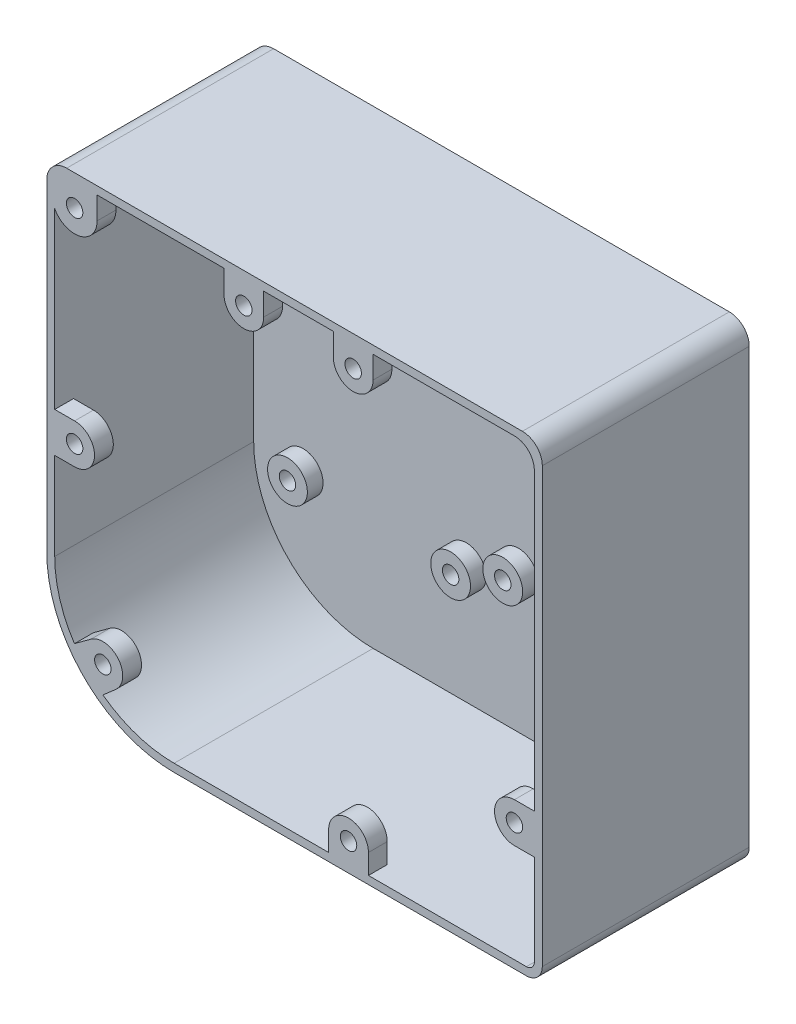
from build123d import *

# Parameters (mm, degrees)
SKETCH5_W           = 153.063311942
SKETCH5_H           = 144.779998932
BOSS_EXTRUDE4_DEPTH = 63.5
FILLET1_R           = 38.1
FILLET2_R           = 2.54
SHELL3_T            = 2.54
SKETCH7_R           = 6.35
BOSS_EXTRUDE5_DEPTH = 5
SKETCH8_R           = 2.625
CUT_EXTRUDE1_DEPTH  = 5
BOSS_EXTRUDE6_DEPTH = 6
FILLET3_R           = 6.35
SKETCH10_R          = 2.625
CUT_EXTRUDE2_DEPTH  = 58.5


with BuildPart() as part:
    # Sketch5 → Boss-Extrude4 (new body)
    with BuildSketch(Plane.XY):
        with Locations((56.058995854, 50.442319529)):
            Rectangle(SKETCH5_W, SKETCH5_H)
    extrude(amount=BOSS_EXTRUDE4_DEPTH)

    # Fillet1
    fillet1_edges = [part.edges().sort_by_distance(p)[0] for p in [
        (-20.472660117, -21.947679937, 31.75),
    ]]
    fillet(fillet1_edges, radius=FILLET1_R)

    # Fillet2
    fillet2_edges = [part.edges().sort_by_distance(p)[0] for p in [
        (132.590651825, -21.947679937, 31.75),
    ]]
    fillet(fillet2_edges, radius=FILLET2_R)

    # Shell3
    shell3_openings = [part.faces().sort_by_distance(p)[0] for p in [
        (57.024076911, 51.357711543, 63.5),
    ]]
    offset(amount=SHELL3_T, openings=shell3_openings, kind=Kind.INTERSECTION)

    # Sketch7 → Boss-Extrude5 (add)
    with BuildSketch(Plane.XY):
        with Locations((62.994650422, 112.820200594)):
            Circle(SKETCH7_R)
        with Locations((123.954650422, 111.804200594)):
            Circle(SKETCH7_R)
        with Locations((64.011650422, 22.578200594)):
            Circle(SKETCH7_R)
        with Locations((124.970650422, 22.396200594)):
            Circle(SKETCH7_R)
        with Locations((-4.569349914, 115.466318873)):
            Circle(SKETCH7_R)
        with Locations((47.373650086, 115.466318873)):
            Circle(SKETCH7_R)
        with Locations((-4.694349914, 15.752318873)):
            Circle(SKETCH7_R)
        with Locations((47.373650086, 15.771318873)):
            Circle(SKETCH7_R)
    extrude(amount=BOSS_EXTRUDE5_DEPTH)

    # Sketch8 → Cut-Extrude1 (cut)
    with BuildSketch(Plane.XY.offset(5)):
        with Locations((-4.694349914, 15.752318873)):
            Circle(SKETCH8_R)
        with Locations((47.373650086, 15.771318873)):
            Circle(SKETCH8_R)
        with Locations((64.011650422, 22.578200594)):
            Circle(SKETCH8_R)
        with Locations((124.970650422, 22.396200594)):
            Circle(SKETCH8_R)
        with Locations((47.373650086, 115.466318873)):
            Circle(SKETCH8_R)
        with Locations((-4.569349914, 115.466318873)):
            Circle(SKETCH8_R)
        with Locations((62.994650422, 112.820200594)):
            Circle(SKETCH8_R)
        with Locations((123.954650422, 111.804200594)):
            Circle(SKETCH8_R)
    extrude(amount=-CUT_EXTRUDE1_DEPTH, mode=Mode.SUBTRACT)

    # Sketch9 → Boss-Extrude6 (add)
    with BuildSketch(Plane.XY.offset(63.5)):
        with BuildLine():
            Line((-6.94761595, 115.657274828), (-6.94761595, 122.832318995))
            Line((-6.94761595, 122.832318995), (-20.472660117, 122.832318995))
            Line((-20.472660117, 122.832318995), (-20.472660117, 115.657274828))
            Line((-20.472660117, 115.657274828), (-20.472660117, 112.316801987))
            ThreePointArc((-20.472660117, 112.316801987), (-12.402234539, 108.691544814), (-6.94761595, 115.657274828))
        make_face()
        with BuildLine():
            Line((33.530571418, 115.657274828), (33.530571418, 122.832318995))
            Line((33.530571418, 122.832318995), (46.230571418, 122.832318995))
            Line((46.230571418, 122.832318995), (46.230571418, 115.657274828))
            ThreePointArc((46.230571418, 115.657274828), (39.880571418, 109.307274828), (33.530571418, 115.657274828))
        make_face()
        with BuildLine():
            Line((68.427420291, 115.710615977), (68.427420291, 122.832318995))
            Line((68.427420291, 122.832318995), (81.127420291, 122.832318995))
            Line((81.127420291, 122.832318995), (81.127420291, 115.710615977))
            ThreePointArc((81.127420291, 115.710615977), (74.777420291, 109.360615977), (68.427420291, 115.710615977))
        make_face()
        with BuildLine():
            Line((126.240651825, 22.296756738), (132.590651825, 22.296756738))
            Line((132.590651825, 22.296756738), (132.590651825, 9.596756738))
            Line((132.590651825, 9.596756738), (126.240651825, 9.596756738))
            ThreePointArc((126.240651825, 9.596756738), (119.890651825, 15.946756738), (126.240651825, 22.296756738))
        make_face()
        with BuildLine():
            Line((-8.880464125, -0.896351485), (-14.122660117, -4.742228331))
            ThreePointArc((-14.122660117, -4.742228331), (-11.33604945, -11.201095808), (-5.089054035, -14.434857763))
            Line((-5.089054035, -14.434857763), (-0.935149274, -10.7884483))
            ThreePointArc((-0.935149274, -10.7884483), (-0.173505163, -2.039817183), (-8.880464125, -0.896351485))
        make_face()
        with BuildLine():
            Line((-14.122660117, 56.792319529), (-20.472660117, 56.792319529))
            Line((-20.472660117, 56.792319529), (-20.472660117, 44.092319529))
            Line((-20.472660117, 44.092319529), (-14.122660117, 44.092319529))
            ThreePointArc((-14.122660117, 44.092319529), (-7.772660117, 50.442319529), (-14.122660117, 56.792319529))
        make_face()
        with BuildLine():
            Line((66.946411889, -15.597679937), (66.946411889, -21.947679937))
            Line((66.946411889, -21.947679937), (79.646411889, -21.947679937))
            Line((79.646411889, -21.947679937), (79.646411889, -15.597679937))
            ThreePointArc((79.646411889, -15.597679937), (73.296411889, -9.247679937), (66.946411889, -15.597679937))
        make_face()
    extrude(amount=-BOSS_EXTRUDE6_DEPTH)

    # Fillet3
    fillet3_edges = [part.edges().sort_by_distance(p)[0] for p in [
        (-20.472660117, 122.832318995, 28.75),
        (132.590651825, 122.832318995, 31.75),
        (-23.012660117, 125.372318995, 30.48),
        (135.130651825, 125.372318995, 30.48),
    ]]
    fillet(fillet3_edges, radius=FILLET3_R)

    # Sketch10 → Cut-Extrude2 (cut)
    with BuildSketch(Plane.XY.offset(63.5)):
        with Locations((-14.122660117, 115.657274828)):
            Circle(SKETCH10_R)
        with Locations((39.880571418, 115.657274828)):
            Circle(SKETCH10_R)
        with Locations((74.777420291, 115.710615977)):
            Circle(SKETCH10_R)
        with Locations((-14.122660117, 50.442319529)):
            Circle(SKETCH10_R)
        with Locations((-5.124288877, -6.016277999)):
            Circle(SKETCH10_R)
        with Locations((73.296411889, -15.597679937)):
            Circle(SKETCH10_R)
        with Locations((126.240651825, 15.946756738)):
            Circle(SKETCH10_R)
    extrude(amount=-CUT_EXTRUDE2_DEPTH, mode=Mode.SUBTRACT)


solid = part.part
